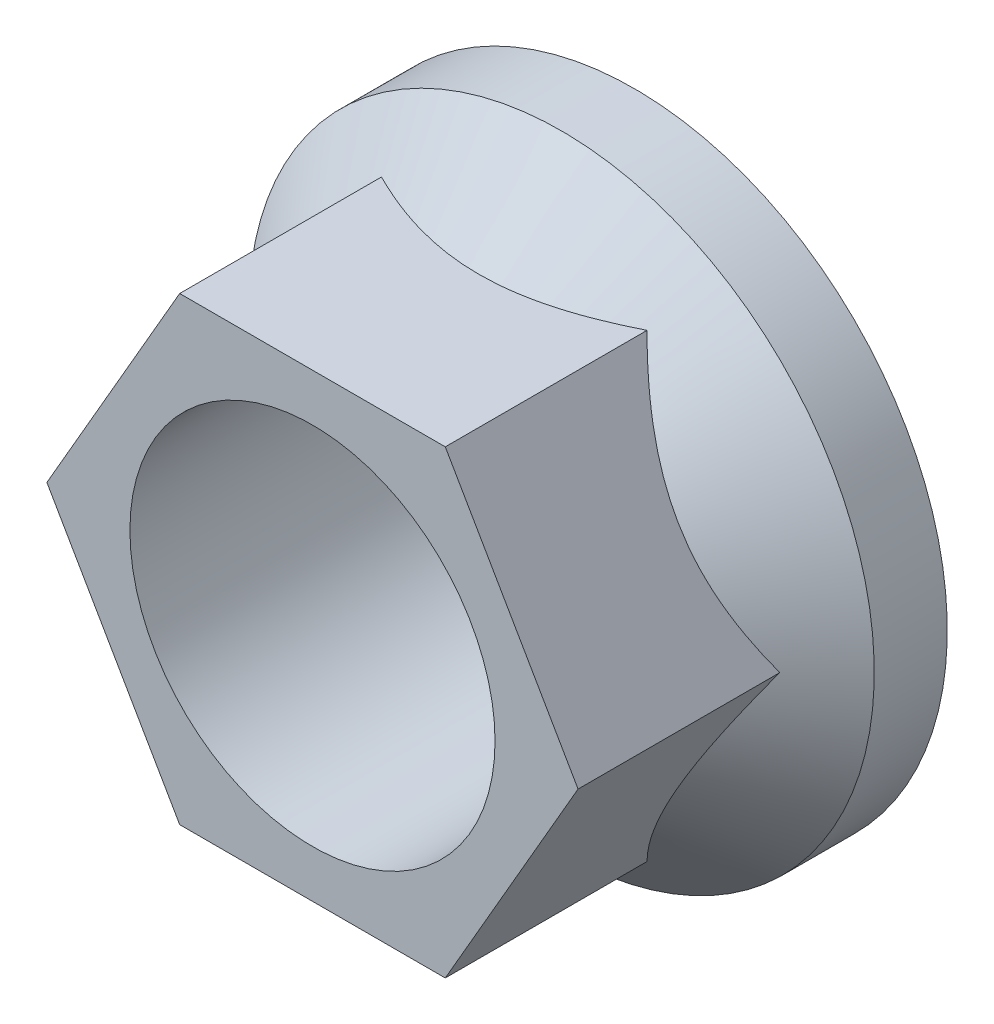
from build123d import *

# Parameters (mm, degrees)
BOSS_EXTRUDE1_REACH = 13.895
SKETCH2_R           = 3.96875


with BuildPart() as part:
    # Sketch1 → Revolve1 (revolve)
    with BuildSketch(Plane(origin=(0, 0, 0), x_dir=(0, 0, -1), z_dir=(1, 0, 0)), mode=Mode.PRIVATE) as revolve1_sk:
        Polygon((0, 3.96875), (-7, 3.96875), (-7, 4.7625), (-3.625, 4.7625), (-1.5875, 6.8), (0, 6.8), align=None)
    revolve(revolve1_sk.sketch.rotate(Axis((0, 0, 0), (0, 0, 1)), 90), axis=Axis((0, 0, 0), (0, 0, 1)))

    # Boss-Extrude1: up to this cone (the profile starts outside it)
    boss_extrude1_end = Plane(origin=(0, 0, 7), z_dir=(0, 0, -1)).offset(-1.387499) * Cone(1e-06, 17.17, 17.169999, align=(Align.CENTER, Align.CENTER, Align.MIN), mode=Mode.PRIVATE)
    # Sketch2 → Boss-Extrude1 (add, up to the surface)
    with BuildSketch(Plane.XY.offset(7), mode=Mode.PRIVATE) as boss_extrude1_sk1:
        Polygon((-2.886751346, 5), (-5.773502692, 0), (-2.886751346, -5), (2.886751346, -5), (5.773502692, 0), (2.886751346, 5), align=None)
        with Locations(Location((0, 0, 0), (0, 0, 180))):
            Circle(SKETCH2_R, mode=Mode.SUBTRACT)
    boss_extrude1_tool1 = extrude(boss_extrude1_sk1.sketch, amount=-BOSS_EXTRUDE1_REACH, mode=Mode.PRIVATE) - boss_extrude1_end
    add(boss_extrude1_tool1.solids().sort_by_distance((-4.197839, 2.423624, 7))[0])


solid = part.part
